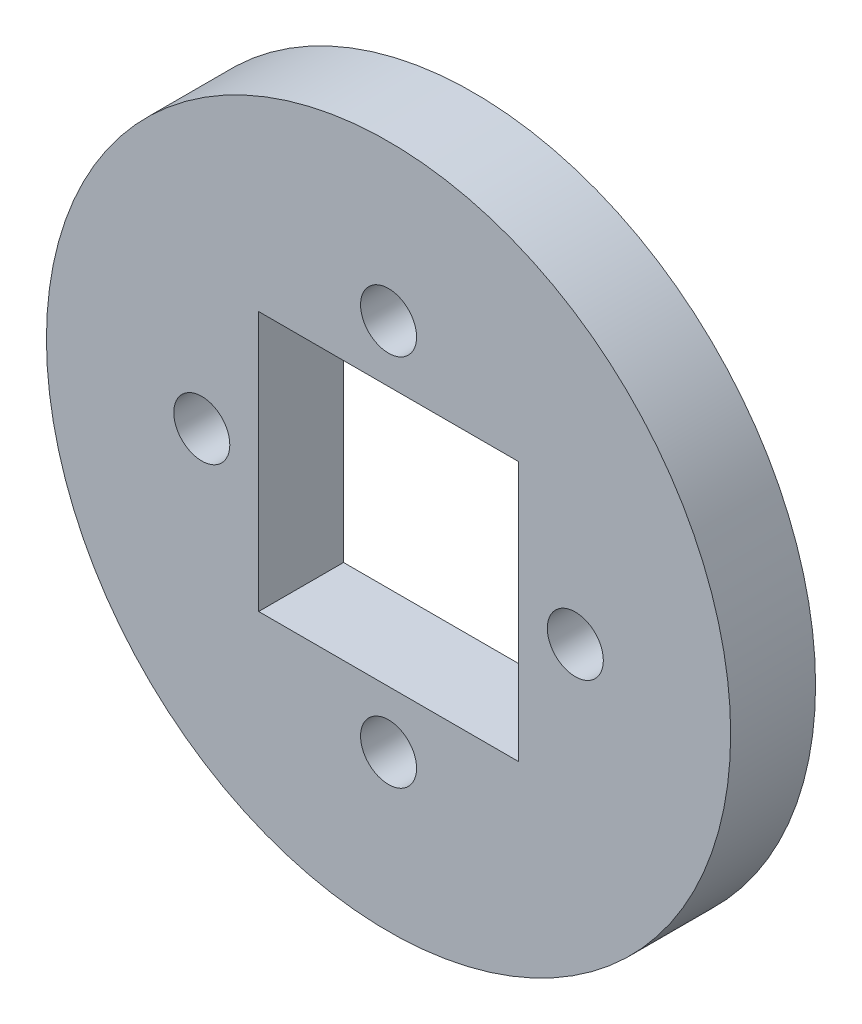
from build123d import *

# Parameters (mm, degrees)
SKETCH1_R           = 40.3
SKETCH1_R_2         = 1.65
SKETCH1_W           = 30.6
SKETCH1_H           = 30.6
BOSS_EXTRUDE1_DEPTH = 10
SKETCH2_R           = 3.3
CUT_EXTRUDE1_DEPTH  = 6


with BuildPart() as part:
    # Sketch1 → Boss-Extrude1 (new body)
    with BuildSketch(Plane.XY):
        Circle(SKETCH1_R)
        with Locations((0, 22)):
            Circle(SKETCH1_R_2, mode=Mode.SUBTRACT)
        with Locations((22, 0)):
            Circle(SKETCH1_R_2, mode=Mode.SUBTRACT)
        with Locations((0, -22)):
            Circle(SKETCH1_R_2, mode=Mode.SUBTRACT)
        with Locations((-22, 0)):
            Circle(SKETCH1_R_2, mode=Mode.SUBTRACT)
        Rectangle(SKETCH1_W, SKETCH1_H, mode=Mode.SUBTRACT)
    extrude(amount=BOSS_EXTRUDE1_DEPTH)

    # Sketch2 → Cut-Extrude1 (cut)
    with BuildSketch(Plane.XY.offset(10)):
        with Locations((22, 0)):
            Circle(SKETCH2_R)
        with Locations((0, 22)):
            Circle(SKETCH2_R)
        with Locations((-22, 0)):
            Circle(SKETCH2_R)
        with Locations((0, -22)):
            Circle(SKETCH2_R)
    extrude(amount=-CUT_EXTRUDE1_DEPTH, mode=Mode.SUBTRACT)


solid = part.part
